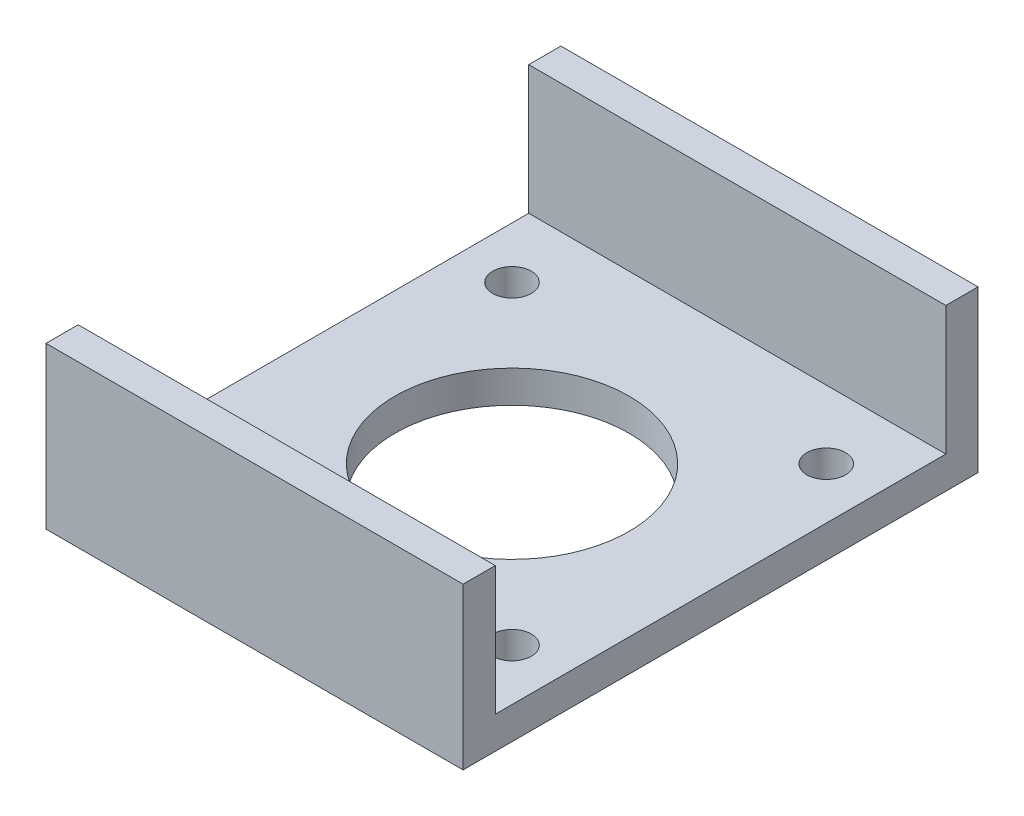
from build123d import *

# Parameters (mm, degrees)
SKETCH1_W           = 41.148
SKETCH1_H           = 50.8
SKETCH1_R           = 11.557
SKETCH1_R_2         = 1.905
BOSS_EXTRUDE1_DEPTH = 3.175
SKETCH2_W           = 41.148
SKETCH2_H           = 3.175
BOSS_EXTRUDE2_DEPTH = 12.7


with BuildPart() as part:
    # Sketch1 → Boss-Extrude1 (new body)
    with BuildSketch(Plane(origin=(0, 0, 0), x_dir=(1, 0, 0), z_dir=(0, 1, 0))):
        Rectangle(SKETCH1_W, SKETCH1_H)
        with Locations(Location((0, 0, 0), (0, 0, 270))):
            Circle(SKETCH1_R, mode=Mode.SUBTRACT)
        with Locations(Location((-15.499999988, 15.499999988, 0), (0, 0, 270))):
            Circle(SKETCH1_R_2, mode=Mode.SUBTRACT)
        with Locations(Location((15.499999988, 15.499999988, 0), (0, 0, 270))):
            Circle(SKETCH1_R_2, mode=Mode.SUBTRACT)
        with Locations(Location((15.499999988, -15.499999988, 0), (0, 0, 270))):
            Circle(SKETCH1_R_2, mode=Mode.SUBTRACT)
        with Locations(Location((-15.499999988, -15.499999988, 0), (0, 0, 270))):
            Circle(SKETCH1_R_2, mode=Mode.SUBTRACT)
    extrude(amount=BOSS_EXTRUDE1_DEPTH)

    # Sketch2 → Boss-Extrude2 (add)
    with BuildSketch(Plane(origin=(0, 3.175, 0), x_dir=(1, 0, 0), z_dir=(0, 1, 0))):
        with Locations((0, -23.8125)):
            Rectangle(SKETCH2_W, SKETCH2_H)
        with Locations((0, 23.8125)):
            Rectangle(SKETCH2_W, SKETCH2_H)
    extrude(amount=BOSS_EXTRUDE2_DEPTH)


solid = part.part
